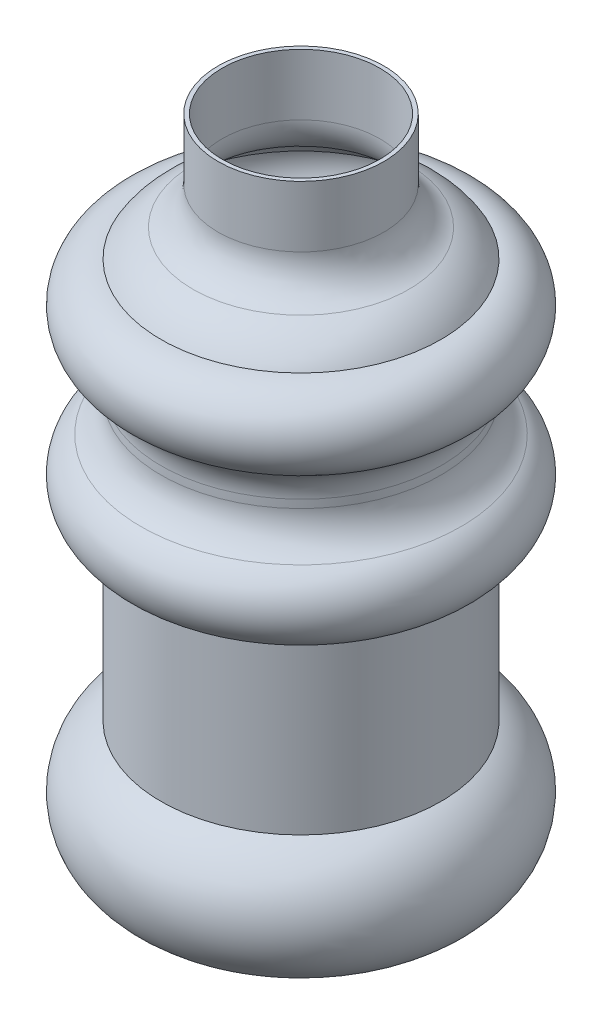
from build123d import *

# Parameters (mm, degrees)
CROQUIS2_R              = 62.186097141
SALIENTE_EXTRUIR1_DEPTH = 70
REDONDEO1_R             = 30
VACIADO1_T              = -3


with BuildPart() as part:
    # Croquis1 → Revolución1 (revolve)
    with BuildSketch(Plane.XY, mode=Mode.PRIVATE) as revoluci_n1_sk:
        with BuildLine():
            Line((0, 0), (-85, 0))
            ThreePointArc((-85, 0), (-133.945315647, 39.784517816), (-105, 95.82575695))
            Line((-105, 95.82575695), (-105, 225.82575695))
            ThreePointArc((-105, 225.82575695), (-135, 255.82575695), (-105, 285.82575695))
            Line((-105, 285.82575695), (-105, 335.82575695))
            ThreePointArc((-105, 335.82575695), (-135, 365.82575695), (-105, 395.82575695))
            ThreePointArc((-105, 395.82575695), (-86.769751798, 413.538993141), (-62.186097141, 420))
            Line((-62.186097141, 420), (0, 420))
            Line((0, 420), (0, 0))
        make_face()
    revolve(revoluci_n1_sk.sketch.rotate(Axis((0, 0, 0), (0, 1, 0)), 270), axis=Axis((0, 0, 0), (0, 1, 0)))

    # Croquis2 → Saliente-Extruir1 (add)
    with BuildSketch(Plane(origin=(0, 420, 0), x_dir=(1, 0, 0), z_dir=(0, 1, 0))):
        with Locations(Location((0, 0, 0), (0, 0, 270))):
            Circle(CROQUIS2_R)
    extrude(amount=SALIENTE_EXTRUIR1_DEPTH)

    # Redondeo1
    redondeo1_edges = [part.edges().sort_by_distance(p)[0] for p in [
        (-62.186097141, 420, 0),
        (0, 335.82575695, 105),
        (0, 285.82575695, 105),
    ]]
    fillet(redondeo1_edges, radius=REDONDEO1_R)

    # Vaciado1
    vaciado1_openings = [part.faces().sort_by_distance(p)[0] for p in [
        (0, 490, 0),
    ]]
    offset(amount=VACIADO1_T, openings=vaciado1_openings, kind=Kind.INTERSECTION)


solid = part.part
